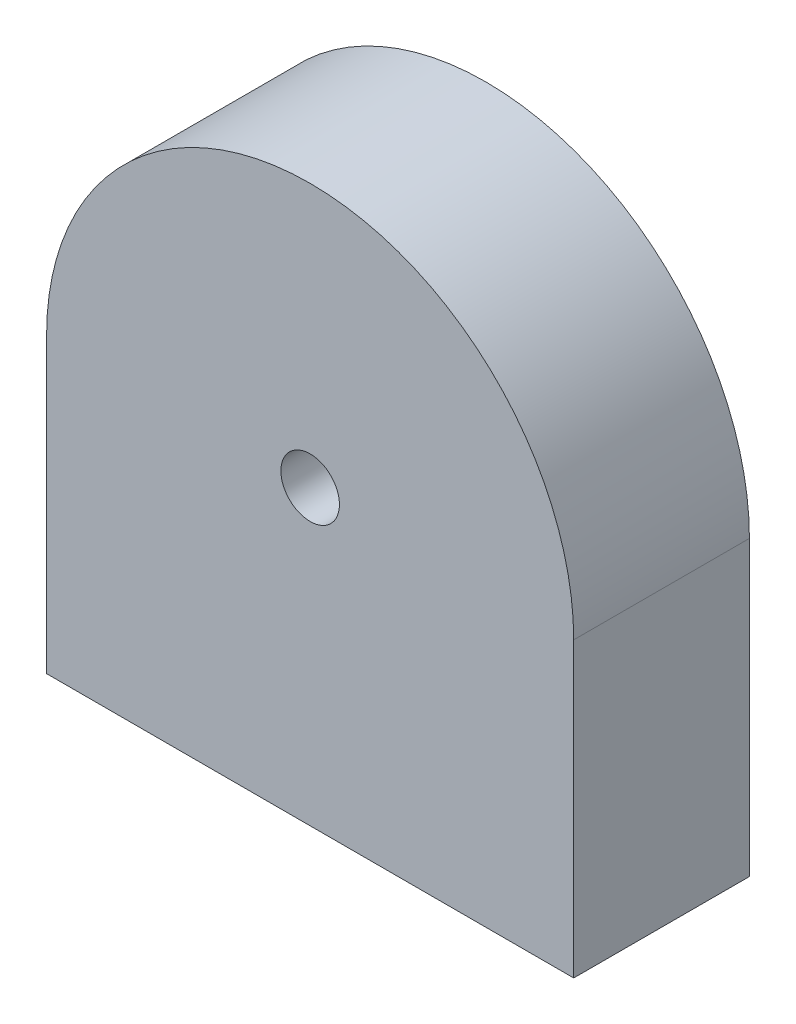
from build123d import *

# Parameters (mm, degrees)
SKETCH1_R           = 0.5
BOSS_EXTRUDE1_DEPTH = 3


with BuildPart() as part:
    # Sketch1 → Boss-Extrude1 (new body)
    with BuildSketch(Plane.XY):
        with BuildLine():
            Line((0, 0), (9, 0))
            Line((9, 0), (9, 5))
            ThreePointArc((9, 5), (4.5, 9.5), (0, 5))
            Line((0, 5), (0, 0))
        make_face()
        with Locations((4.5, 5)):
            Circle(SKETCH1_R, mode=Mode.SUBTRACT)
    extrude(amount=BOSS_EXTRUDE1_DEPTH)


solid = part.part
